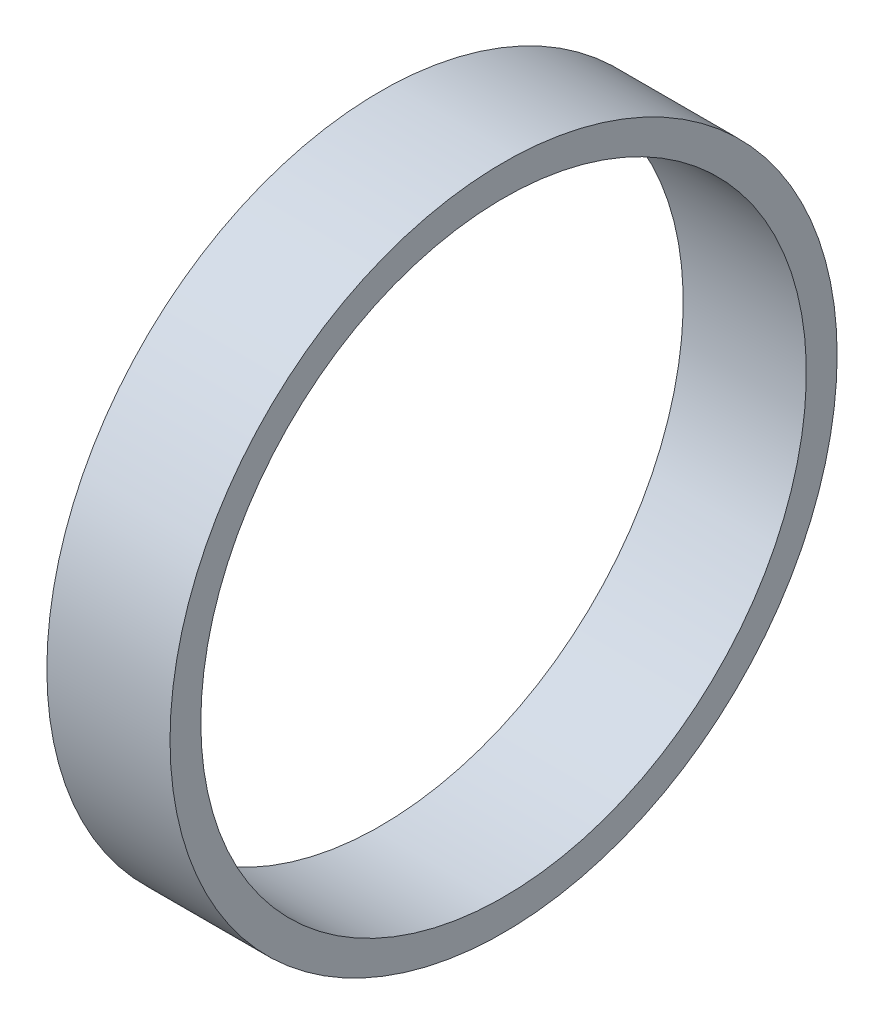
from build123d import *

# Parameters (mm, degrees)
AXIAL_PROFILE_MM_W = 4.8
AXIAL_PROFILE_MM_H = 1.2


with BuildPart() as part:
    # Axial profile (mm) → Full revolution (revolve)
    with BuildSketch(Plane.XY, mode=Mode.PRIVATE) as full_revolution_sk:
        with Locations((0.5, 12.4)):
            Rectangle(AXIAL_PROFILE_MM_W, AXIAL_PROFILE_MM_H)
    revolve(full_revolution_sk.sketch.rotate(Axis((-110, 0, 0), (1, 0, 0)), 90), axis=Axis((-110, 0, 0), (1, 0, 0)))


solid = part.part
